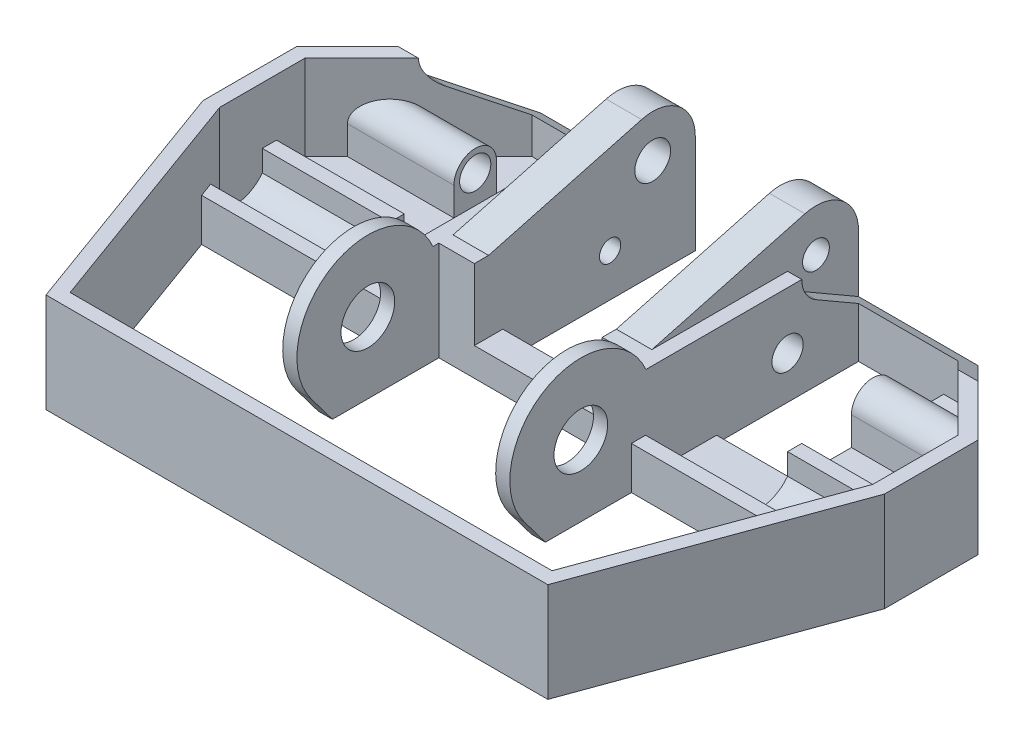
from build123d import *

# Parameters (mm, degrees)
BOSS_EXTRUDE1_DEPTH = 22.225
BOSS_EXTRUDE2_DEPTH = 22.225
SKETCH4_W           = 28.575
SKETCH4_H           = 43.053
CUT_EXTRUDE1_DEPTH  = 125.991552151
CUT_EXTRUDE4_REACH  = 101.697
SKETCH9_W           = 28.575
SKETCH9_H           = 16.728193257
BOSS_EXTRUDE3_REACH = 142.089
SKETCH11_W          = 19.05
SKETCH11_H          = 19.05
CUT_EXTRUDE5_DEPTH  = 7.9375
BOSS_EXTRUDE6_REACH = 156.463
BOSS_EXTRUDE4_DEPTH = 3.175
CUT_EXTRUDE6_REACH  = 142.089
SKETCH19_R          = 6
CUT_EXTRUDE7_DEPTH  = 138.803544436


with BuildPart() as part:
    # Sketch1 → Boss-Extrude1 (new, symmetric)
    with BuildSketch(Plane(origin=(0, 0, 0), x_dir=(0, 0, -1), z_dir=(1, 0, 0))):
        with BuildLine():
            Line((9.525, -22.225), (9.525, 0))
            ThreePointArc((9.525, 0), (5.795727419, 7.558780899), (-2.471885813, 9.198663247))
            Line((-2.471885813, 9.198663247), (-36.703, 0))
            Line((-36.703, 0), (-36.703, -22.225))
            Line((-36.703, -22.225), (9.525, -22.225))
        make_face()
    extrude(amount=BOSS_EXTRUDE1_DEPTH, both=True)

    # Sketch3 → Boss-Extrude2 (add)
    with BuildSketch(Plane(origin=(0, 0, 0), x_dir=(-1, 0, 0), z_dir=(0, -1, 0))):
        Polygon((22.225, 9.525), (22.225, -36.703), (-22.225, -36.703), (-22.225, 9.525), (-48.940128061, 9.525), (-76.2, -17.734871939), (-76.2, -38.659838164), (-56.111331957, -93.853), (56.111331957, -93.853), (76.2, -38.659838164), (76.2, -17.734871939), (48.940128061, 9.525), align=None)
        Polygon((73.025, -19.05), (47.625, 6.35), (25.4, 6.35), (25.4, -49.403), (22.225, -49.403), (22.225, -39.878), (-22.225, -39.878), (-22.225, -49.403), (-25.4, -49.403), (-25.4, 6.35), (-47.625, 6.35), (-73.025, -19.05), (-73.025, -38.1), (-53.888173023, -90.678), (53.888173023, -90.678), (73.025, -38.1), align=None, mode=Mode.SUBTRACT)
    extrude(amount=BOSS_EXTRUDE2_DEPTH)

    # Sketch4 → Cut-Extrude1 (cut, through all)
    with BuildSketch(Plane.XZ.offset(22.225)):
        with Locations((0, 12.0015)):
            Rectangle(SKETCH4_W, SKETCH4_H)
    extrude(amount=-CUT_EXTRUDE1_DEPTH, mode=Mode.SUBTRACT)

    # Sketch6 → Cut-Revolve1 (revolve, cut)
    with BuildSketch(Plane(origin=(0, 0, 0), x_dir=(1, 0, 0), z_dir=(0, 1, 0)), mode=Mode.PRIVATE) as cut_revolve1_sk:
        Polygon((-22.225, 4), (17.775, 4), (17.775, 3), (22.225, 3), (22.225, 6.35), (78.807413882, 6.35), (78.807413882, 0), (22.225, 0), (-22.225, 0), (-88.579385408, 0), (-88.579385408, 6.35), (-22.225, 6.35), align=None)
    revolve(cut_revolve1_sk.sketch.rotate(Axis((-22.225, 0, 0), (1, 0, 0)), 180), axis=Axis((-22.225, 0, 0), (1, 0, 0)), mode=Mode.SUBTRACT)

    # Sketch9 → Cut-Extrude4 (cut, up to next)
    with BuildSketch(Plane(origin=(0, 0, 33.528), x_dir=(-1, 0, 0), z_dir=(0, 0, -1)), mode=Mode.PRIVATE) as cut_extrude4_sk1:
        with Locations((0, -7.510903372)):
            Rectangle(SKETCH9_W, SKETCH9_H)
    cut_extrude4_tool1 = extrude(cut_extrude4_sk1.sketch, amount=-CUT_EXTRUDE4_REACH, mode=Mode.PRIVATE) & part.part
    add(cut_extrude4_tool1.solids().sort_by_distance((0, -7.510903, 33.528))[0], mode=Mode.SUBTRACT)

    # Sketch10 → Boss-Extrude3 (add, up to next)
    with BuildSketch(Plane(origin=(25.4, 0, 0), x_dir=(0, 0, -1), z_dir=(1, 0, 0)), mode=Mode.PRIVATE) as boss_extrude3_sk1:
        with BuildLine():
            Line((-28.575, -17.4625), (-28.575, -12.7))
            Line((-28.575, -12.7), (-25.4, -12.7))
            Line((-25.4, -12.7), (-25.4, -22.225))
            Line((-25.4, -22.225), (-44.45, -22.225))
            Line((-44.45, -22.225), (-44.45, -12.7))
            Line((-44.45, -12.7), (-41.275, -12.7))
            Line((-41.275, -12.7), (-41.275, -17.4625))
            ThreePointArc((-41.275, -17.4625), (-34.925, -20.6375), (-28.575, -17.4625))
        make_face()
    boss_extrude3_tool1 = extrude(boss_extrude3_sk1.sketch, amount=BOSS_EXTRUDE3_REACH, mode=Mode.PRIVATE) - part.part
    boss_extrude3 = boss_extrude3_tool1.solids().sort_by_distance((25.4, -15.08125, 28.362015))[0]
    add(boss_extrude3)

    # Mirror1: Boss-Extrude3 across plane
    add(boss_extrude3.mirror(Plane(origin=(0, 0, 0), x_dir=(0, 0, 1), z_dir=(1, 0, 0))))

    # Sketch11 → Cut-Extrude5 (cut)
    with BuildSketch(Plane(origin=(0, -12.7, 0), x_dir=(1, 0, 0), z_dir=(0, 1, 0))):
        with Locations((-34.925, -25.4)):
            Rectangle(SKETCH11_W, SKETCH11_H)
        with Locations((34.925, -25.4)):
            Rectangle(SKETCH11_W, SKETCH11_H)
    extrude(amount=-CUT_EXTRUDE5_DEPTH, mode=Mode.SUBTRACT)

    # Sketch18 → Boss-Extrude6 (add, up to next)
    with BuildSketch(Plane(origin=(-44.45, 0, 0), x_dir=(0, 0, -1), z_dir=(1, 0, 0)), mode=Mode.PRIVATE) as boss_extrude6_sk1:
        with BuildLine():
            Line((-25.4, -22.225), (6.35, -22.225))
            Line((6.35, -22.225), (6.35, -19.05))
            Line((6.35, -19.05), (-4.7625, -19.05))
            Line((-4.7625, -19.05), (-4.7625, -12.7))
            ThreePointArc((-4.7625, -12.7), (-9.525, -7.9375), (-14.2875, -12.7))
            Line((-14.2875, -12.7), (-14.2875, -19.05))
            Line((-14.2875, -19.05), (-25.4, -19.05))
            Line((-25.4, -19.05), (-25.4, -22.225))
        make_face()
    boss_extrude6_tool1 = extrude(boss_extrude6_sk1.sketch, amount=-BOSS_EXTRUDE6_REACH, mode=Mode.PRIVATE) - part.part
    boss_extrude6 = boss_extrude6_tool1.solids().sort_by_distance((-44.45, -17.372872, 9.525))[0]
    add(boss_extrude6)

    # Mirror3: Boss-Extrude6 across plane
    add(boss_extrude6.mirror(Plane(origin=(0, 0, 0), x_dir=(0, 0, 1), z_dir=(1, 0, 0))))

    # Sketch14 → Cut-Revolve2 (revolve, cut)
    with BuildSketch(Plane(origin=(0, -12.7, 0), x_dir=(-1, 0, 0), z_dir=(0, -1, 0))):
        Polygon((-73.701947692, -6.0325), (-19.05, -6.0325), (-19.05, -7.14375), (-14.2875, -7.14375), (-14.2875, -9.525), (-73.701947692, -9.525), align=None)
        Polygon((14.2875, -9.525), (14.2875, -7.14375), (19.05, -7.14375), (19.05, -6.0325), (73.701947692, -6.0325), (73.701947692, -9.525), align=None)
    revolve(axis=Axis((73.701947692, -12.7, 9.525), (-1, 0, 0)), mode=Mode.SUBTRACT)

    # Sketch15 → Boss-Extrude4 (add)
    with BuildSketch(Plane(origin=(-22.225, 0, 0), x_dir=(0, 0, -1), z_dir=(1, 0, 0))):
        with BuildLine():
            Line((-39.878, -22.225), (-63.685165738, -22.225))
            Line((-63.685165738, -22.225), (-68.447876585, -15.881827396))
            ThreePointArc((-68.447876585, -15.881827396), (-60.777164568, 8.708997158), (-39.878, -6.35))
            Line((-39.878, -6.35), (-39.878, -22.225))
        make_face()
    boss_extrude4 = extrude(amount=-BOSS_EXTRUDE4_DEPTH)

    # Mirror2: Boss-Extrude4 across plane
    add(boss_extrude4.mirror(Plane(origin=(0, 0, 0), x_dir=(0, 0, 1), z_dir=(1, 0, 0))))

    # Cut-Extrude6: up to this face of the body (flat: up to its plane)
    cut_extrude6_end = Plane(part.part.faces().sort_by_distance((25.4, -9.178544074, 35.806928902))[0])
    # Sketch19 → Cut-Extrude6 (cut, up to the picked face)
    with BuildSketch(Plane.ZY.offset(25.4), mode=Mode.PRIVATE) as cut_extrude6_sk1:
        with Locations((55.753, -6.35)):
            Circle(SKETCH19_R)
    cut_extrude6_tool1 = split(extrude(cut_extrude6_sk1.sketch, amount=-CUT_EXTRUDE6_REACH, mode=Mode.PRIVATE), bisect_by=cut_extrude6_end, keep=Keep.BOTH, mode=Mode.PRIVATE)
    add(cut_extrude6_tool1.solids().sort_by(Axis((-25.4, -6.35, 55.753), (1, 0, 0)))[0], mode=Mode.SUBTRACT)

    # Sketch20 → Cut-Extrude7 (cut, through all)
    with BuildSketch(Plane.ZY.offset(22.225)):
        Polygon((3.175, -5.499261314), (-9.525, -12.831609733), (-9.525, 0), (3.175, 0), align=None)
    cut_extrude7 = extrude(amount=CUT_EXTRUDE7_DEPTH, mode=Mode.SUBTRACT)

    # Mirror4: Cut-Extrude7 across plane
    add(cut_extrude7.mirror(Plane(origin=(0, 0, 0), x_dir=(0, 0, 1), z_dir=(1, 0, 0))), mode=Mode.SUBTRACT)


solid = part.part
